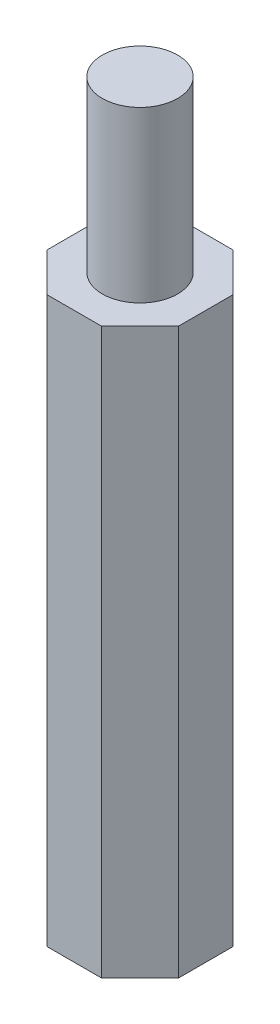
from build123d import *

# Parameters (mm, degrees)
EXTRUSION1_DEPTH        = 15
ESQUISSE2_R             = 2
EXTRUSION2_DEPTH        = 9
ESQUISSE3_R             = 2
ENL_V_MAT_EXTRU_1_DEPTH = 9


with BuildPart() as part:
    # Esquisse1 → Extrusion1 (new, symmetric)
    with BuildSketch(Plane(origin=(0, 0, 0), x_dir=(1, 0, 0), z_dir=(0, 1, 0))):
        Polygon((-1.449747468, 3.5), (1.449747468, 3.5), (3.5, 1.449747468), (3.5, -1.449747468), (1.449747468, -3.5), (-1.449747468, -3.5), (-3.5, -1.449747468), (-3.5, 1.449747468), align=None)
    extrude(amount=EXTRUSION1_DEPTH, both=True)

    # Esquisse2 → Extrusion2 (add)
    with BuildSketch(Plane(origin=(0, 15, 0), x_dir=(1, 0, 0), z_dir=(0, 1, 0))):
        with Locations(Location((0, 0, 0), (0, 0, 270))):
            Circle(ESQUISSE2_R)
    extrude(amount=EXTRUSION2_DEPTH)

    # Esquisse3 → Enlèv. mat.-Extru.1 (cut)
    with BuildSketch(Plane.XZ.offset(15)):
        with Locations(Location((0, 0, 0), (0, 0, 90))):
            Circle(ESQUISSE3_R)
    extrude(amount=-ENL_V_MAT_EXTRU_1_DEPTH, mode=Mode.SUBTRACT)


solid = part.part
